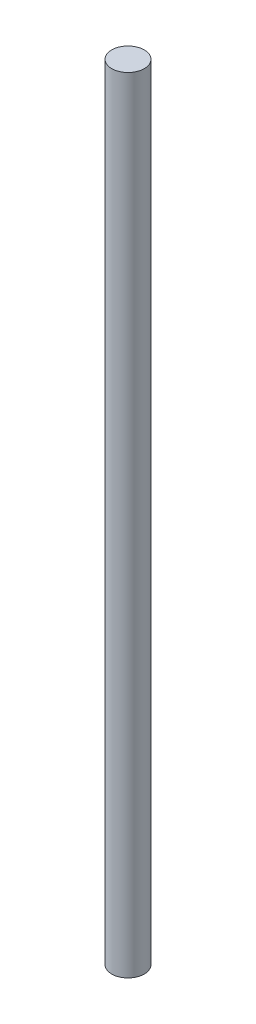
from build123d import *

# Parameters (mm, degrees)
SKETCH1_R           = 2.5
BOSS_EXTRUDE1_DEPTH = 120.65


with BuildPart() as part:
    # Sketch1 → Boss-Extrude1 (new body)
    with BuildSketch(Plane(origin=(0, 0, 0), x_dir=(1, 0, 0), z_dir=(0, 1, 0))):
        with Locations(Location((0, 0, 0), (0, 0, 90))):
            Circle(SKETCH1_R)
    extrude(amount=BOSS_EXTRUDE1_DEPTH)


solid = part.part
